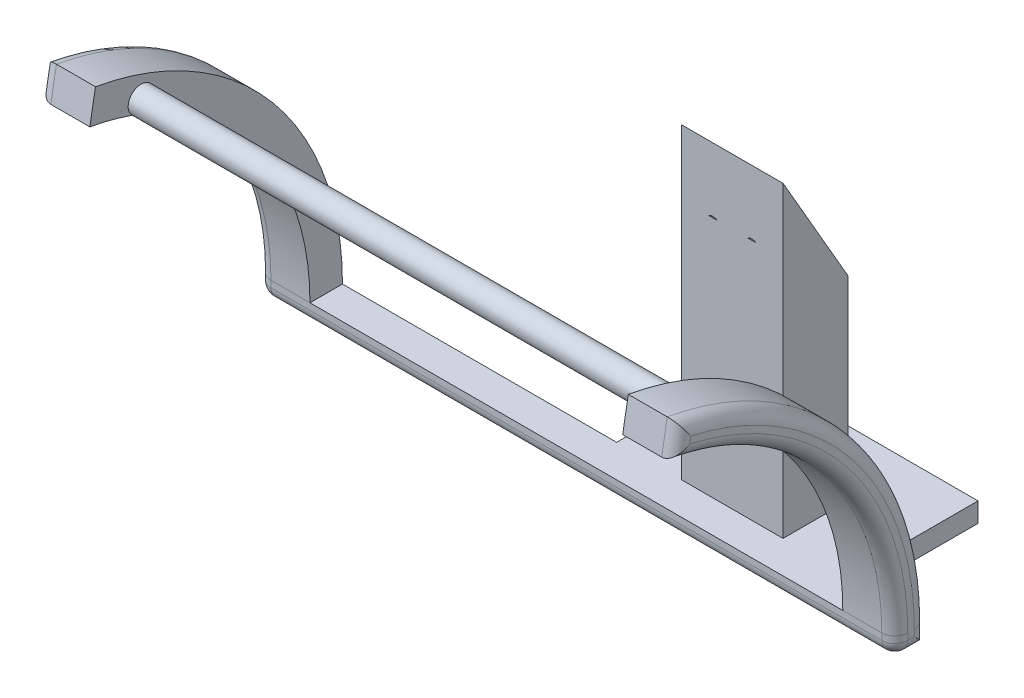
from build123d import *

# Parameters (mm, degrees)
SKETCH1_W           = 17.805
SKETCH1_H           = 20
SKETCH1_W_2         = 38
SKETCH1_H_2         = 5
BOSS_EXTRUDE1_DEPTH = 3
SKETCH3_R           = 1.5
CUT_EXTRUDE1_DEPTH  = 5
SKETCH7_W           = 15.61
SKETCH7_H           = 10
BOSS_EXTRUDE4_DEPTH = 30
BOSS_EXTRUDE5_DEPTH = 15.61
SKETCH9_R           = 1.5
CUT_EXTRUDE2_DEPTH  = 5
BOSS_EXTRUDE6_DEPTH = 8
FILLET4_R           = 2
BOSS_EXTRUDE7_DEPTH = 82


with BuildPart() as part:
    # Sketch1 → Boss-Extrude1 (new body)
    with BuildSketch(Plane(origin=(0, 0, 0), x_dir=(1, 0, 0), z_dir=(0, 1, 0))):
        Polygon((9.368218391, 0.25), (-8.436781609, 0.25), (-26.241781609, 0.25), (-38.436781609, 0.25), (-38.436781609, -4.75), (21.563218391, -4.75), (21.563218391, 0.25), align=None)
        with Locations((0.465718391, 10.25)):
            Rectangle(SKETCH1_W, SKETCH1_H)
        with Locations((-17.339281609, 10.25)):
            Rectangle(SKETCH1_W, SKETCH1_H)
        with Locations((-57.436781609, -2.25)):
            Rectangle(SKETCH1_W_2, SKETCH1_H_2)
    extrude(amount=BOSS_EXTRUDE1_DEPTH)

    # Sketch3 → Cut-Extrude1 (cut)
    with BuildSketch(Plane.XZ):
        with Locations(Location((-20.484687418, -8.75, 0), (0, 0, 270))):
            Circle(SKETCH3_R)
        with Locations(Location((-8.434877213, -16.25, 0), (0, 0, 270))):
            Circle(SKETCH3_R)
        with Locations(Location((3.614932992, -8.75, 0), (0, 0, 270))):
            Circle(SKETCH3_R)
    extrude(amount=-CUT_EXTRUDE1_DEPTH, mode=Mode.SUBTRACT)

    # Sketch7 → Boss-Extrude4 (add)
    with BuildSketch(Plane(origin=(0, 3, 0), x_dir=(1, 0, 0), z_dir=(0, 1, 0))):
        with Locations((-8.436781609, 5.25)):
            Rectangle(SKETCH7_W, SKETCH7_H)
    extrude(amount=BOSS_EXTRUDE4_DEPTH)

    # Sketch8 → Boss-Extrude5 (add)
    with BuildSketch(Plane.ZY.offset(16.241781609)):
        Polygon((-10.25, 33), (-0.25, 50.320508076), (-0.25, 33), align=None)
    extrude(amount=-BOSS_EXTRUDE5_DEPTH)

    # Sketch9 → Cut-Extrude2 (cut)
    with BuildSketch(Plane(origin=(0, 12.688380194, -21.976919162), x_dir=(1, 0, 0), z_dir=(0, 0.4999999999999978, -0.8660254037844399))):
        with Locations(Location((-11.436781609, -33.453838325, 0), (0, 0, 270))):
            Circle(SKETCH9_R)
        with Locations(Location((-5.436781609, -33.453838325, 0), (0, 0, 270))):
            Circle(SKETCH9_R)
    extrude(amount=-CUT_EXTRUDE2_DEPTH, mode=Mode.SUBTRACT)

    # Sketch2 → Boss-Extrude6 (add)
    with BuildSketch(Plane(origin=(21.563218391, 0, 0), x_dir=(0, 0, -1), z_dir=(1, 0, 0))):
        with BuildLine():
            Line((-37.762183827, 48.301156639), (-38.630424716, 43.377117874))
            ThreePointArc((-38.630424716, 43.377117874), (-14.342177832, 29.354291997), (-4.75, 3))
            Line((-4.75, 3), (0.25, 3))
            ThreePointArc((0.25, 3), (-10.511955617, 32.568230046), (-37.762183827, 48.301156639))
        make_face()
    boss_extrude6 = extrude(amount=-BOSS_EXTRUDE6_DEPTH)

    # Mirror1: Boss-Extrude6 across plane
    add(boss_extrude6.mirror(Plane.ZY.offset(27.436781609)))

    # Fillet4
    fillet4_edges = [part.edges().sort_by_distance(p)[0] for p in [
        (-76.436781609, 29.354291997, 14.342177832),
        (-76.436781609, 32.568230046, 10.511955617),
        (-76.436781609, 45.839137256, 38.196304271),
        (21.563218391, 0, 2.25),
        (21.563218391, 1.5, 4.75),
        (21.563218391, 1.5, -0.25),
        (-76.436781609, 1.5, -0.25),
        (-76.436781609, 1.5, 4.75),
        (-76.436781609, 0, 2.25),
        (21.563218391, 29.354291997, 14.342177832),
        (-27.436781609, 0, 4.75),
        (21.563218391, 32.568230046, 10.511955617),
        (21.563218391, 45.839137256, 38.196304271),
    ]]
    fillet(fillet4_edges, radius=FILLET4_R)

    # Sketch10 → Boss-Extrude7 (add)
    with BuildSketch(Plane(origin=(-68.436781609, 0, 0), x_dir=(0, 0, -1), z_dir=(1, 0, 0))):
        with BuildLine():
            ThreePointArc((-32.079730178, 41.653896608), (-31.378929062, 41.398858318), (-30.682882682, 41.131115585))
            ThreePointArc((-30.682882682, 41.131115585), (-29.29976717, 41.733383141), (-28.730833488, 43.130540682))
            ThreePointArc((-28.730833488, 43.130540682), (-31.537743217, 44.960539777), (-32.079730178, 41.653896608))
        make_face()
    extrude(amount=BOSS_EXTRUDE7_DEPTH)


solid = part.part
